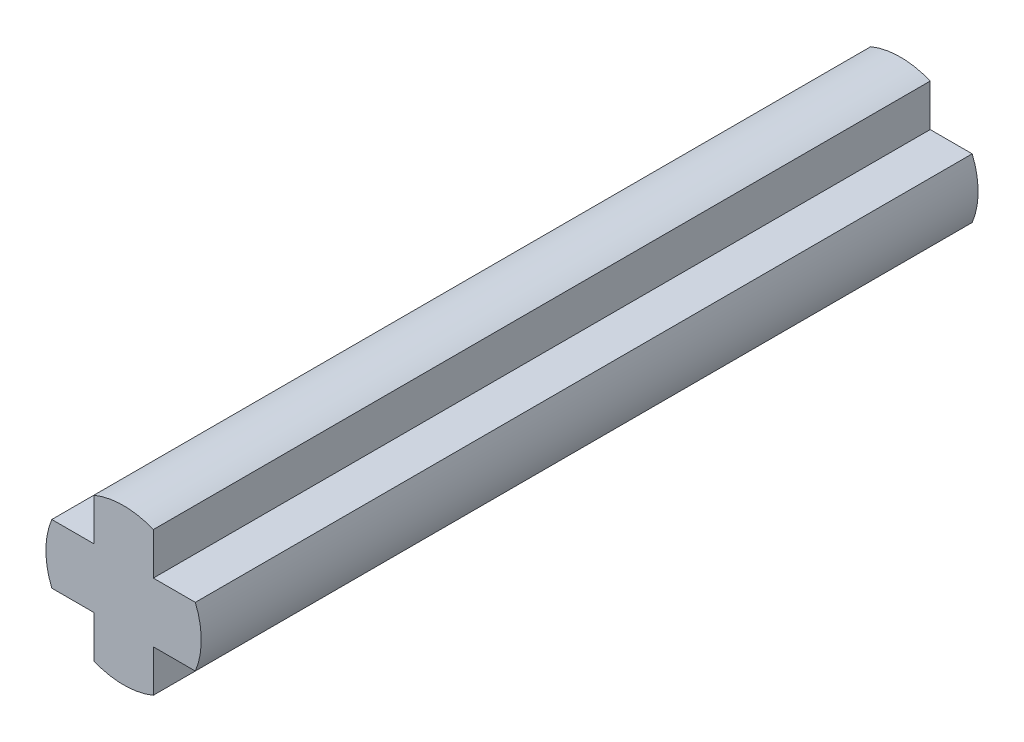
from build123d import *

# Parameters (mm, degrees)
BOSS_EXTRUDE1_DEPTH = 11.75


with BuildPart() as part:
    # Sketch1 → Boss-Extrude1 (new, symmetric)
    with BuildSketch(Plane.XY):
        with BuildLine():
            Line((-0.9, 2.170829335), (-0.9, 0.9))
            Line((-0.9, 0.9), (-2.170829335, 0.9))
            ThreePointArc((-2.170829335, 0.9), (-2.35, 0), (-2.170829335, -0.9))
            Line((-2.170829335, -0.9), (-0.9, -0.9))
            Line((-0.9, -0.9), (-0.9, -2.170829335))
            ThreePointArc((-0.9, -2.170829335), (0, -2.35), (0.9, -2.170829335))
            Line((0.9, -2.170829335), (0.9, -0.9))
            Line((0.9, -0.9), (2.170829335, -0.9))
            ThreePointArc((2.170829335, -0.9), (2.35, 0), (2.170829335, 0.9))
            Line((2.170829335, 0.9), (0.9, 0.9))
            Line((0.9, 0.9), (0.9, 2.170829335))
            ThreePointArc((0.9, 2.170829335), (0, 2.35), (-0.9, 2.170829335))
        make_face()
    extrude(amount=BOSS_EXTRUDE1_DEPTH, both=True)


solid = part.part
